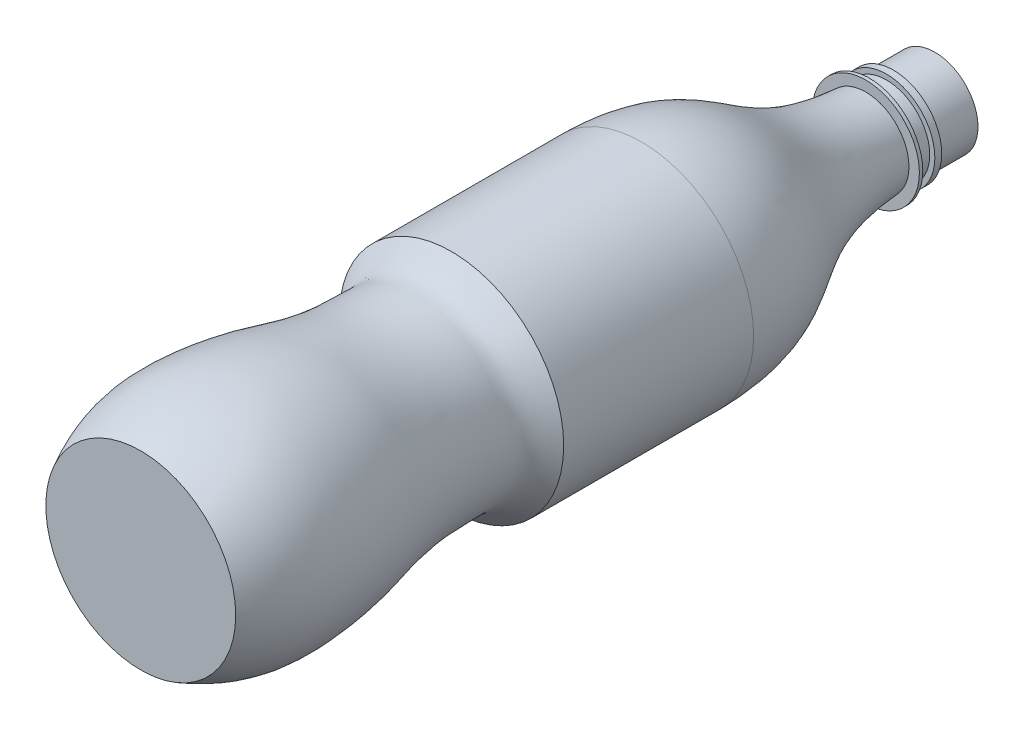
from build123d import *


with BuildPart() as part:
    # Sketch1 → Revolve3 (revolve)
    with BuildSketch(Plane(origin=(0, 0, 0), x_dir=(1, 0, 0), z_dir=(0, 1, 0))):
        with BuildLine():
            Line((0, 0), (0, 230))
            Line((0, 230), (12.5, 230))
            Line((12.5, 230), (12.5, 218))
            Line((12.5, 218), (14, 217.999999999))
            Line((14, 217.999999999), (13.999927666, 216))
            Line((13.999927666, 216), (12.515611153, 216))
            Line((12.515611153, 216), (12.5, 210.98853812))
            Line((12.5, 210.98853812), (15.499978569, 210.999877804))
            Line((15.499978569, 210.999877804), (15.515611153, 210))
            Line((15.515611153, 210), (12.5, 210))
            add(Edge.make_bspline(
                [(12.5, 210), (14.922130771, 175.127506462), (31.979338754, 179.564350306), (32.5, 145)],
                knots=[0, 0, 0, 0, 1, 1, 1, 1], degree=3))
            Line((32.5, 145), (32.5, 90))
            add(Edge.make_bspline(
                [(32.5, 90), (25.721809169, 83.316192042), (26.936513276, 82.414233108), (26.810048481, 66.997733089), (28.46817148, 57.131214713), (32.096286638, 44.010772021), (34.987931681, 23.776222362), (33.214929298, 10.739901), (27.5, 0)],
                knots=[0, 0, 0, 0, 0.249131323, 0.300005802, 0.485551569, 0.527189357, 0.693190465, 1, 1, 1, 1], degree=3))
            Line((27.5, 0), (0, 0))
        make_face()
    revolve(axis=Axis((0, 0, 0), (0, 0, -1)))


solid = part.part
